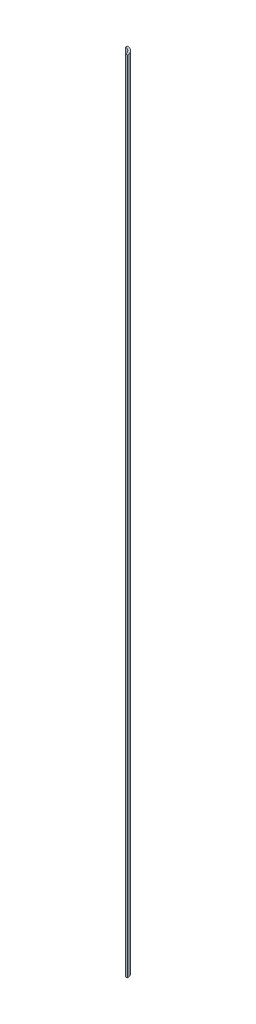
from build123d import *

# Parameters (mm, degrees)
BOSS_EXTRUDE1_DEPTH = 203


with BuildPart() as part:
    # Sketch1 → Boss-Extrude1 (new body)
    with BuildSketch(Plane(origin=(0, 0, 0), x_dir=(1, 0, 0), z_dir=(0, 1, 0))):
        with BuildLine():
            Line((0, 2), (0, 1.5))
            ThreePointArc((0, 1.5), (1.060660172, 1.060660172), (1.5, 0))
            Line((1.5, 0), (2, 0))
            ThreePointArc((2, 0), (1.414213562, 1.414213562), (0, 2))
        make_face()
    extrude(amount=BOSS_EXTRUDE1_DEPTH)


solid = part.part
